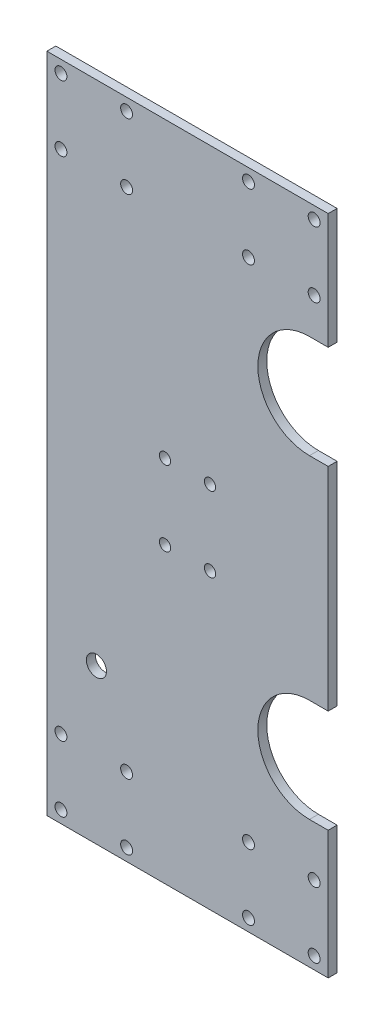
from build123d import *

# Parameters (mm, degrees)
CROQUIS1_W                    = 150
CROQUIS1_H                    = 353
SALIENTE_EXTRUIR1_DEPTH       = 4.7625
CROQUIS2_R                    = 3.175
CORTAR_EXTRUIR1_DEPTH         = 192.833082148
CORTAR_EXTRUIR2_REACH         = 193.833
CROQUIS3_R                    = 3
CORTAR_EXTRUIR3_REACH         = 193.833
CROQUIS4_R                    = 5
CORTAR_EXTRUIR7_REACH         = 193.833
TALADRO_ROSCADO_1_2_134_D     = 10.71626
TALADRO_ROSCADO_1_2_134_DEPTH = 35.17
TALADRO_ROSCADO_1_2_134_TIP   = 3.219489309


with BuildPart() as part:
    # Croquis1 → Saliente-Extruir1 (new body)
    with BuildSketch(Plane.XY):
        Rectangle(CROQUIS1_W, CROQUIS1_H)
    extrude(amount=SALIENTE_EXTRUIR1_DEPTH)

    # Croquis2 → Cortar-Extruir1 (cut, through all)
    with BuildSketch(Plane.XY.offset(4.7625)):
        with Locations((-67.5, 170)):
            Circle(CROQUIS2_R)
        with Locations((-32.5, 170)):
            Circle(CROQUIS2_R)
        with Locations((-67.5, 135)):
            Circle(CROQUIS2_R)
        with Locations((-32.5, 135)):
            Circle(CROQUIS2_R)
        with Locations((32.5, 170)):
            Circle(CROQUIS2_R)
        with Locations((67.5, 170)):
            Circle(CROQUIS2_R)
        with Locations((32.5, 135)):
            Circle(CROQUIS2_R)
        with Locations((67.5, 135)):
            Circle(CROQUIS2_R)
        with Locations((-67.5, -135)):
            Circle(CROQUIS2_R)
        with Locations((-32.5, -135)):
            Circle(CROQUIS2_R)
        with Locations((-67.5, -170)):
            Circle(CROQUIS2_R)
        with Locations((-32.5, -170)):
            Circle(CROQUIS2_R)
        with Locations((32.5, -170)):
            Circle(CROQUIS2_R)
        with Locations((32.5, -135)):
            Circle(CROQUIS2_R)
        with Locations((67.5, -135)):
            Circle(CROQUIS2_R)
        with Locations((67.5, -170)):
            Circle(CROQUIS2_R)
    extrude(amount=-CORTAR_EXTRUIR1_DEPTH, mode=Mode.SUBTRACT)

    # Croquis3 → Cortar-Extruir2 (cut, up to next)
    with BuildSketch(Plane(origin=(0, 0, 0), x_dir=(-1, 0, 0), z_dir=(0, 0, -1)), mode=Mode.PRIVATE) as cortar_extruir2_sk1:
        with Locations((-12, 20)):
            Circle(CROQUIS3_R)
    cortar_extruir2_tool1 = extrude(cortar_extruir2_sk1.sketch, amount=-CORTAR_EXTRUIR2_REACH, mode=Mode.PRIVATE) & part.part
    # Croquis3 → Cortar-Extruir2 (cut, up to next)
    with BuildSketch(Plane(origin=(0, 0, 0), x_dir=(-1, 0, 0), z_dir=(0, 0, -1)), mode=Mode.PRIVATE) as cortar_extruir2_sk2:
        with Locations((12, 20)):
            Circle(CROQUIS3_R)
    cortar_extruir2_tool2 = extrude(cortar_extruir2_sk2.sketch, amount=-CORTAR_EXTRUIR2_REACH, mode=Mode.PRIVATE) & part.part
    # Croquis3 → Cortar-Extruir2 (cut, up to next)
    with BuildSketch(Plane(origin=(0, 0, 0), x_dir=(-1, 0, 0), z_dir=(0, 0, -1)), mode=Mode.PRIVATE) as cortar_extruir2_sk3:
        with Locations((12, -20)):
            Circle(CROQUIS3_R)
    cortar_extruir2_tool3 = extrude(cortar_extruir2_sk3.sketch, amount=-CORTAR_EXTRUIR2_REACH, mode=Mode.PRIVATE) & part.part
    # Croquis3 → Cortar-Extruir2 (cut, up to next)
    with BuildSketch(Plane(origin=(0, 0, 0), x_dir=(-1, 0, 0), z_dir=(0, 0, -1)), mode=Mode.PRIVATE) as cortar_extruir2_sk4:
        with Locations((-12, -20)):
            Circle(CROQUIS3_R)
    cortar_extruir2_tool4 = extrude(cortar_extruir2_sk4.sketch, amount=-CORTAR_EXTRUIR2_REACH, mode=Mode.PRIVATE) & part.part
    add(cortar_extruir2_tool1.solids().sort_by_distance((12, 20, 0))[0], mode=Mode.SUBTRACT)
    add(cortar_extruir2_tool2.solids().sort_by_distance((-12, 20, 0))[0], mode=Mode.SUBTRACT)
    add(cortar_extruir2_tool3.solids().sort_by_distance((-12, -20, 0))[0], mode=Mode.SUBTRACT)
    add(cortar_extruir2_tool4.solids().sort_by_distance((12, -20, 0))[0], mode=Mode.SUBTRACT)

    # Croquis4 → Cortar-Extruir3 (cut, up to next)
    with BuildSketch(Plane.XY.offset(4.7625), mode=Mode.PRIVATE) as cortar_extruir3_sk1:
        with Locations((-48.59, -94.11)):
            Circle(CROQUIS4_R)
    cortar_extruir3_tool1 = extrude(cortar_extruir3_sk1.sketch, amount=-CORTAR_EXTRUIR3_REACH, mode=Mode.PRIVATE) & part.part
    add(cortar_extruir3_tool1.solids().sort_by_distance((-48.59, -94.11, 4.7625))[0], mode=Mode.SUBTRACT)

    # Croquis8 → Cortar-Extruir7 (cut, up to next)
    with BuildSketch(Plane.XY.offset(4.7625), mode=Mode.PRIVATE) as cortar_extruir7_sk1:
        with BuildLine():
            Line((75, 114.73), (65, 114.73))
            ThreePointArc((65, 114.73), (37.5, 87.23), (65, 59.73))
            Line((65, 59.73), (75, 59.73))
            Line((75, 59.73), (75, 114.73))
        make_face()
    cortar_extruir7_tool1 = extrude(cortar_extruir7_sk1.sketch, amount=-CORTAR_EXTRUIR7_REACH, mode=Mode.PRIVATE) & part.part
    # Croquis8 → Cortar-Extruir7 (cut, up to next)
    with BuildSketch(Plane.XY.offset(4.7625), mode=Mode.PRIVATE) as cortar_extruir7_sk2:
        with BuildLine():
            Line((75, -53.27), (65, -53.27))
            ThreePointArc((65, -53.27), (37.5, -80.77), (65, -108.27))
            Line((65, -108.27), (75, -108.27))
            Line((75, -108.27), (75, -53.27))
        make_face()
    cortar_extruir7_tool2 = extrude(cortar_extruir7_sk2.sketch, amount=-CORTAR_EXTRUIR7_REACH, mode=Mode.PRIVATE) & part.part
    add(cortar_extruir7_tool1.solids().sort_by_distance((58.604644, 87.23, 4.7625))[0], mode=Mode.SUBTRACT)
    add(cortar_extruir7_tool2.solids().sort_by_distance((58.604644, -80.77, 4.7625))[0], mode=Mode.SUBTRACT)

    # Taladro roscado 1/2-134
    with Locations(Plane.XY.offset(4.7625)):
        with Locations((-48.59, -94.11)):
            Hole(TALADRO_ROSCADO_1_2_134_D / 2, depth=TALADRO_ROSCADO_1_2_134_DEPTH)
            with Locations((0, 0, -(TALADRO_ROSCADO_1_2_134_DEPTH + TALADRO_ROSCADO_1_2_134_TIP / 2))):  # 118° drill point
                Cone(0, TALADRO_ROSCADO_1_2_134_D / 2, TALADRO_ROSCADO_1_2_134_TIP, mode=Mode.SUBTRACT)


solid = part.part
